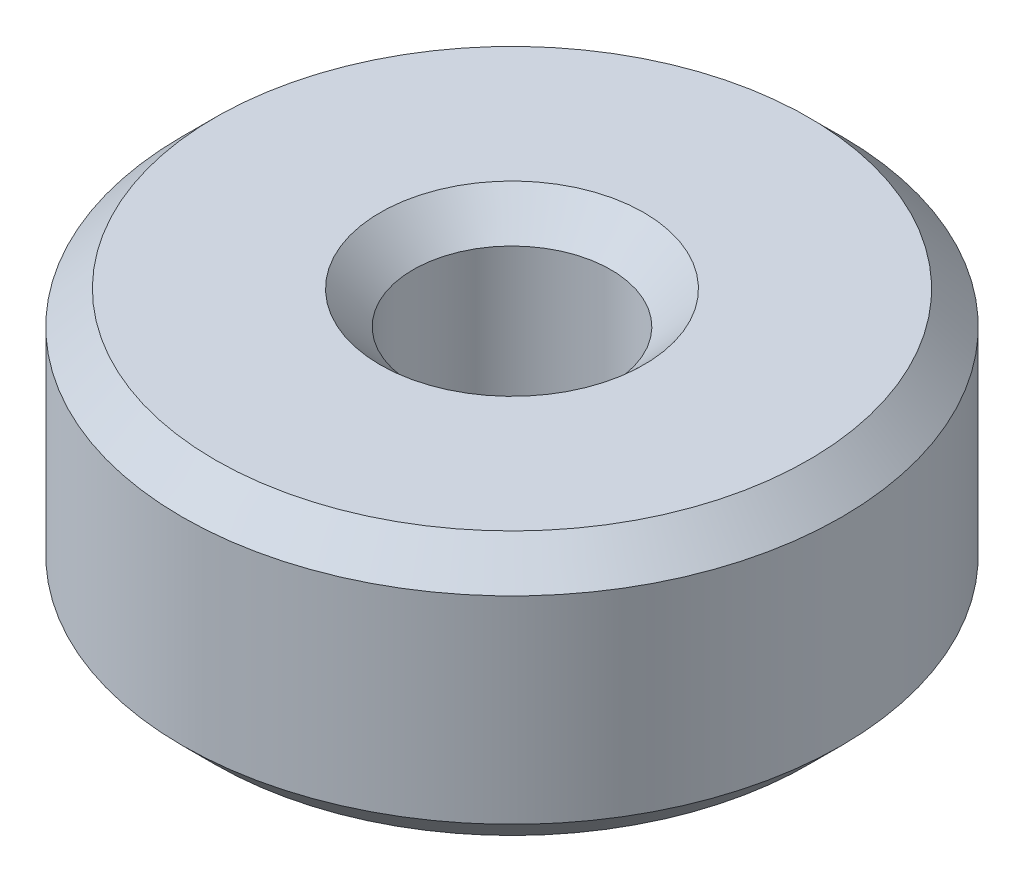
from build123d import *

# Parameters (mm, degrees)
SKETCH_1_R      = 5
SKETCH_1_R_2    = 1.5
EXTRUDE_1_DEPTH = 4
CHAMFER_1_SIZE  = 0.5


with BuildPart() as part:
    # 草图1 → 凸台-拉伸1 (new body)
    with BuildSketch(Plane(origin=(0, 0, 0), x_dir=(1, 0, 0), z_dir=(0, 1, 0))):
        with Locations(Location((0, 0, 0), (0, 0, 270))):
            Circle(SKETCH_1_R)
        with Locations(Location((0, 0, 0), (0, 0, 270))):
            Circle(SKETCH_1_R_2, mode=Mode.SUBTRACT)
    extrude(amount=EXTRUDE_1_DEPTH)

    # 倒角1
    chamfer_1_edges = [part.edges().sort_by_distance(p)[0] for p in [
        (0, 0, -5),
        (0, 4, -5),
        (0, 4, -1.5),
    ]]
    chamfer(chamfer_1_edges, length=CHAMFER_1_SIZE)


solid = part.part
